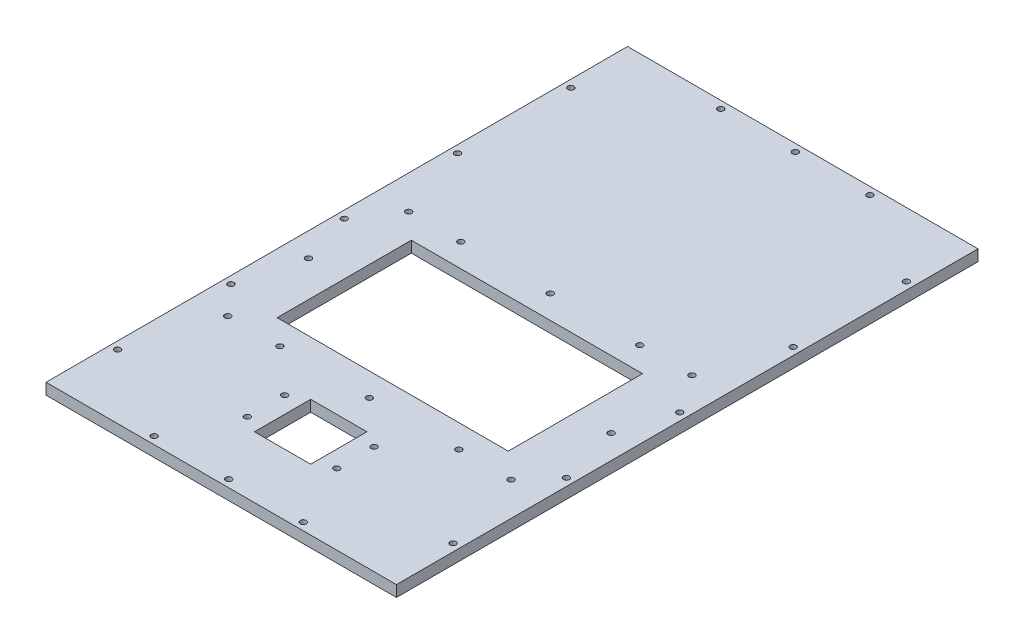
from build123d import *

# Parameters (mm, degrees)
SKETCH1_W                  = 298.45
SKETCH1_H                  = 495.3
BOSS_EXTRUDE1_DEPTH        = 4.7625
CUT_EXTRUDE1_DEPTH         = 290.291114191
CUT_EXTRUDE1_DEPTH_BACK    = 290.291114191
SKETCH3_W                  = 196.85
SKETCH3_H                  = 114.3
SKETCH20_W                 = 47.879
SKETCH20_H                 = 47.879
CUT_EXTRUDE5_DEPTH         = 290.291114191
F_10_CLEARANCE_HOLE1_D     = 5.1054
F_10_CLEARANCE_HOLE1_DEPTH = 10.668
F_10_CLEARANCE_HOLE1_TIP   = 1.533816902
F_10_CLEARANCE_HOLE4_D     = 5.1054
LPATTERN3_COUNT            = 3
LPATTERN3_PITCH            = 63.5
MIRROR2_COPY_1_D           = 5.1054
MIRROR2_COPY_2_D           = 5.1054
F_10_CLEARANCE_HOLE5_D     = 5.1054
LPATTERN4_COUNT            = 3
LPATTERN4_PITCH            = 96.52
LPATTERN4_COL_COUNT        = 3
LPATTERN4_COL_PITCH        = 96.52
MIRROR3_COPY_1_D           = 5.1054
MIRROR3_COPY_2_D           = 5.1054
MIRROR3_COPY_3_D           = 5.1054
MIRROR3_COPY_4_D           = 5.1054
F_10_CLEARANCE_HOLE6_D     = 5.1054
F_10_CLEARANCE_HOLE7_D     = 5.1054
F_1_4_20_TAPPED_HOLE1_D    = 5.1054


with BuildPart() as part:
    # Sketch1 → Boss-Extrude1 (new, symmetric)
    with BuildSketch(Plane(origin=(0, 0, 0), x_dir=(1, 0, 0), z_dir=(0, 1, 0))):
        Rectangle(SKETCH1_W, SKETCH1_H)
    extrude(amount=BOSS_EXTRUDE1_DEPTH, both=True)

    # Sketch3 → Cut-Extrude1 (cut, two sides: drawn at the far end of the back side and taken through both)
    with BuildSketch(Plane(origin=(0, 4.7625, 0), x_dir=(1, 0, 0), z_dir=(0, 1, 0)).offset(-CUT_EXTRUDE1_DEPTH_BACK)):
        with Locations((0, -44.45)):
            Rectangle(SKETCH3_W, SKETCH3_H)
    extrude(amount=CUT_EXTRUDE1_DEPTH + CUT_EXTRUDE1_DEPTH_BACK, mode=Mode.SUBTRACT)

    # Sketch20 → Cut-Extrude5 (cut, through all)
    with BuildSketch(Plane.XZ.offset(4.7625)):
        with Locations((0, 171.45)):
            Rectangle(SKETCH20_W, SKETCH20_H)
    extrude(amount=-CUT_EXTRUDE5_DEPTH, mode=Mode.SUBTRACT)

    # #10 Clearance Hole1
    with Locations(Plane(origin=(0, -4.7625, 0), x_dir=(-1, 0, 0), z_dir=(0, -1, 0))):
        with Locations((-38.1, -155.575), (38.1, -155.575), (38.1, -187.325), (-38.1, -187.325)):
            Hole(F_10_CLEARANCE_HOLE1_D / 2, depth=F_10_CLEARANCE_HOLE1_DEPTH)
            with Locations((0, 0, -(F_10_CLEARANCE_HOLE1_DEPTH + F_10_CLEARANCE_HOLE1_TIP / 2))):  # 118° drill point
                Cone(0, F_10_CLEARANCE_HOLE1_D / 2, F_10_CLEARANCE_HOLE1_TIP, mode=Mode.SUBTRACT)

    # #10 Clearance Hole4 (through all)
    with Locations(Plane(origin=(0, 4.7625, 0), x_dir=(1, 0, 0), z_dir=(0, 1, 0))):
        with Locations((-63.5, 241.3)):
            f_10_clearance_hole4 = Hole(F_10_CLEARANCE_HOLE4_D / 2)

    # LPattern3: #10 Clearance Hole4 ×3
    with Locations(*[(i * LPATTERN3_PITCH, 0, 0) for i in range(1, LPATTERN3_COUNT)]):
        add(f_10_clearance_hole4, mode=Mode.SUBTRACT)

    # Mirror2: #10 Clearance Hole4 across plane
    add(f_10_clearance_hole4.mirror(Plane.XY), mode=Mode.SUBTRACT)

    # Mirror2 copy 1 (through all)
    with Locations(Plane(origin=(63.5, 4.7625, 0), x_dir=(1, 0, 0), z_dir=(0, 1, 0))):
        with Locations((-63.5, -241.3)):
            Hole(MIRROR2_COPY_1_D / 2)

    # Mirror2 copy 2 (through all)
    with Locations(Plane(origin=(127, 4.7625, 0), x_dir=(1, 0, 0), z_dir=(0, 1, 0))):
        with Locations((-63.5, -241.3)):
            Hole(MIRROR2_COPY_2_D / 2)

    # #10 Clearance Hole5 (through all)
    with Locations(Plane(origin=(0, 4.7625, 0), x_dir=(1, 0, 0), z_dir=(0, 1, 0))):
        with Locations((-142.875, 0)):
            f_10_clearance_hole5 = Hole(F_10_CLEARANCE_HOLE5_D / 2)

    # LPattern4: #10 Clearance Hole5 ×3
    with Locations(*[(0, 0, -i * LPATTERN4_PITCH) for i in range(1, LPATTERN4_COUNT)]):
        add(f_10_clearance_hole5, mode=Mode.SUBTRACT)

    # LPattern4 col: #10 Clearance Hole5 ×3
    with Locations(*[(0, 0, i * LPATTERN4_COL_PITCH) for i in range(1, LPATTERN4_COL_COUNT)]):
        add(f_10_clearance_hole5, mode=Mode.SUBTRACT)

    # Mirror3: #10 Clearance Hole5 across plane
    add(f_10_clearance_hole5.mirror(Plane(origin=(0, 0, 0), x_dir=(0, 0, 1), z_dir=(1, 0, 0))), mode=Mode.SUBTRACT)

    # Mirror3 copy 1 (through all)
    with Locations(Plane(origin=(0, 4.7625, -96.52), x_dir=(-1, 0, 0), z_dir=(0, 1, 0))):
        with Locations((-142.875, 0)):
            Hole(MIRROR3_COPY_1_D / 2)

    # Mirror3 copy 2 (through all)
    with Locations(Plane(origin=(0, 4.7625, -193.04), x_dir=(-1, 0, 0), z_dir=(0, 1, 0))):
        with Locations((-142.875, 0)):
            Hole(MIRROR3_COPY_2_D / 2)

    # Mirror3 copy 3 (through all)
    with Locations(Plane(origin=(0, 4.7625, 96.52), x_dir=(-1, 0, 0), z_dir=(0, 1, 0))):
        with Locations((-142.875, 0)):
            Hole(MIRROR3_COPY_3_D / 2)

    # Mirror3 copy 4 (through all)
    with Locations(Plane(origin=(0, 4.7625, 193.04), x_dir=(-1, 0, 0), z_dir=(0, 1, 0))):
        with Locations((-142.875, 0)):
            Hole(MIRROR3_COPY_4_D / 2)

    # #10 Clearance Hole6 (through all)
    with Locations(Plane(origin=(0, 4.7625, 0), x_dir=(1, 0, 0), z_dir=(0, 1, 0))):
        with Locations((120.65, 32.5755), (120.65, -121.4755), (-120.65, -121.4755), (-120.65, 32.5755)):
            Hole(F_10_CLEARANCE_HOLE6_D / 2)

    # #10 Clearance Hole7 (through all)
    with Locations(Plane(origin=(0, 4.7625, 0), x_dir=(1, 0, 0), z_dir=(0, 1, 0))):
        with Locations((76.2, 32.5755), (0, 32.5755), (-76.2, 32.5755), (76.2, -121.4755), (0, -121.4755), (-76.2, -121.4755)):
            Hole(F_10_CLEARANCE_HOLE7_D / 2)

    # 1/4-20 Tapped Hole1 (through all)
    with Locations(Plane(origin=(0, 4.7625, 0), x_dir=(1, 0, 0), z_dir=(0, 1, 0))):
        with Locations((-128.905, -44.45), (128.905, -44.45)):
            Hole(F_1_4_20_TAPPED_HOLE1_D / 2)


solid = part.part
